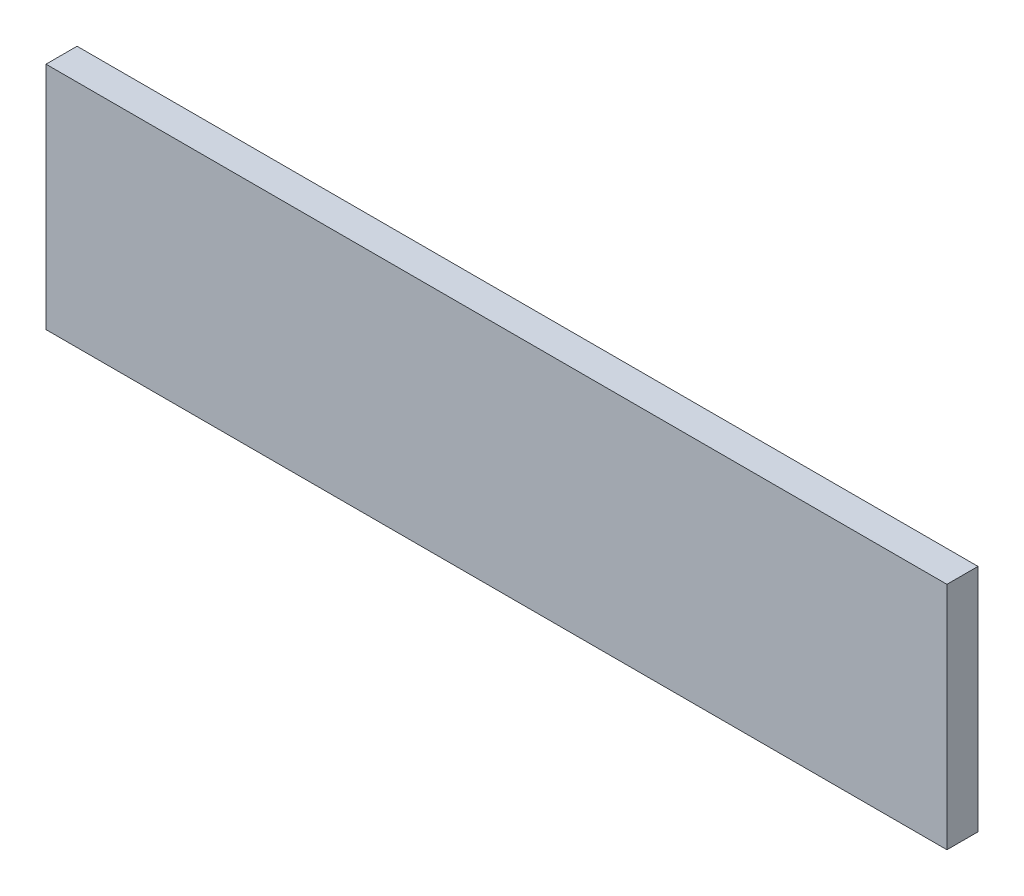
from build123d import *

# Parameters (mm, degrees)
SKETCH1_W           = 290
SKETCH1_H           = 74
BOSS_EXTRUDE1_DEPTH = 10


with BuildPart() as part:
    # Sketch1 → Boss-Extrude1 (new body)
    with BuildSketch(Plane.XY):
        with Locations((55, 30)):
            Rectangle(SKETCH1_W, SKETCH1_H)
    extrude(amount=BOSS_EXTRUDE1_DEPTH)


solid = part.part
